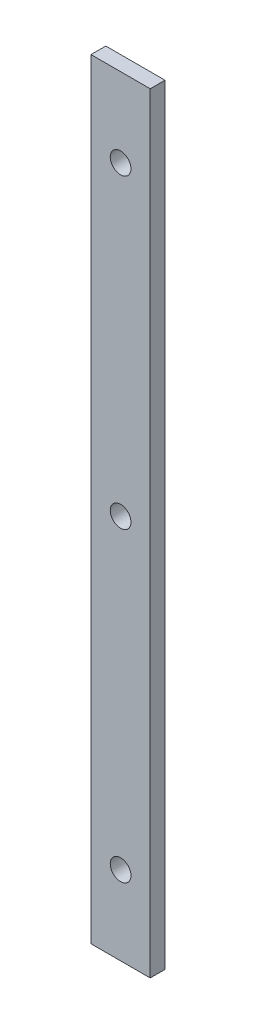
from build123d import *

# Parameters (mm, degrees)
SKETCH1_W           = 12
SKETCH1_H           = 156
BOSS_EXTRUDE1_DEPTH = 3
CUT_EXTRUDE1_REACH  = 115.611
SKETCH2_R           = 2.1


with BuildPart() as part:
    # Sketch1 → Boss-Extrude1 (new body)
    with BuildSketch(Plane.XY):
        with Locations((76.55, 0)):
            Rectangle(SKETCH1_W, SKETCH1_H)
    extrude(amount=BOSS_EXTRUDE1_DEPTH)

    # Sketch2 → Cut-Extrude1 (cut, up to next)
    with BuildSketch(Plane(origin=(0, 0, 0), x_dir=(-1, 0, 0), z_dir=(0, 0, -1)), mode=Mode.PRIVATE) as cut_extrude1_sk1:
        with Locations((-76.55, -62)):
            Circle(SKETCH2_R)
    cut_extrude1_tool1 = extrude(cut_extrude1_sk1.sketch, amount=-CUT_EXTRUDE1_REACH, mode=Mode.PRIVATE) & part.part
    # Sketch2 → Cut-Extrude1 (cut, up to next)
    with BuildSketch(Plane(origin=(0, 0, 0), x_dir=(-1, 0, 0), z_dir=(0, 0, -1)), mode=Mode.PRIVATE) as cut_extrude1_sk2:
        with Locations((-76.55, 0)):
            Circle(SKETCH2_R)
    cut_extrude1_tool2 = extrude(cut_extrude1_sk2.sketch, amount=-CUT_EXTRUDE1_REACH, mode=Mode.PRIVATE) & part.part
    # Sketch2 → Cut-Extrude1 (cut, up to next)
    with BuildSketch(Plane(origin=(0, 0, 0), x_dir=(-1, 0, 0), z_dir=(0, 0, -1)), mode=Mode.PRIVATE) as cut_extrude1_sk3:
        with Locations((-76.55, 62)):
            Circle(SKETCH2_R)
    cut_extrude1_tool3 = extrude(cut_extrude1_sk3.sketch, amount=-CUT_EXTRUDE1_REACH, mode=Mode.PRIVATE) & part.part
    add(cut_extrude1_tool1.solids().sort_by_distance((76.55, -62, 0))[0], mode=Mode.SUBTRACT)
    add(cut_extrude1_tool2.solids().sort_by_distance((76.55, 0, 0))[0], mode=Mode.SUBTRACT)
    add(cut_extrude1_tool3.solids().sort_by_distance((76.55, 62, 0))[0], mode=Mode.SUBTRACT)


solid = part.part
